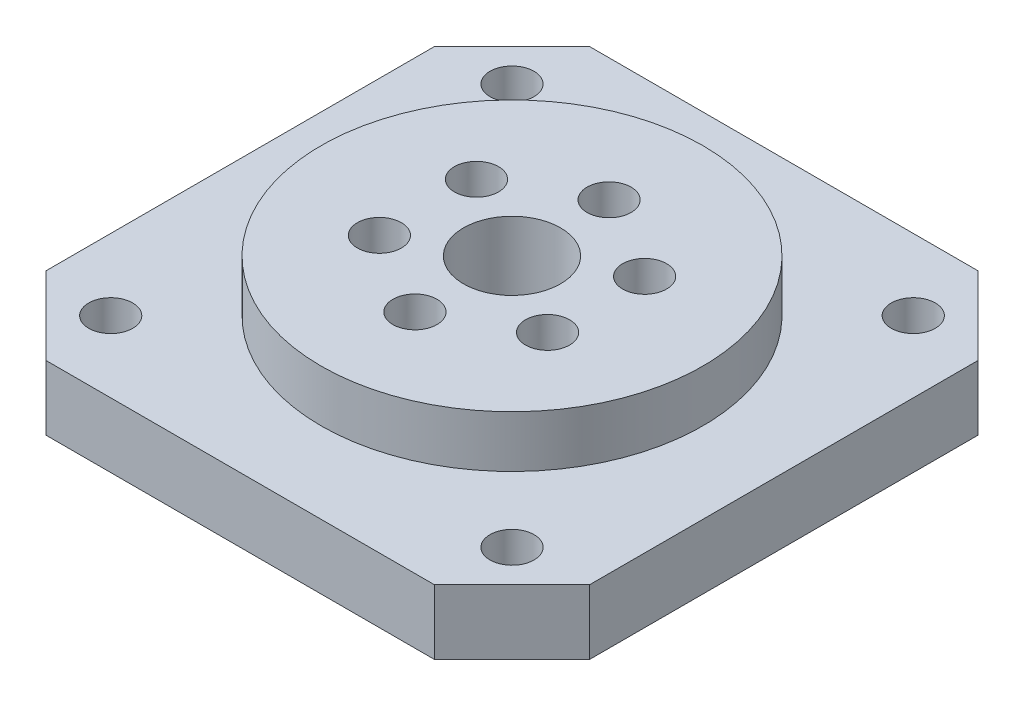
from build123d import *

# Parameters (mm, degrees)
BOSS_EXTRUDE1_DEPTH  = 5
M3_CLEARANCE_HOLE1_D = 3.4
SKETCH2_R            = 14.75
BOSS_EXTRUDE2_DEPTH  = 4
SKETCH4_R            = 12
CUT_EXTRUDE1_DEPTH   = 3.5
CUT_EXTRUDE2_DEPTH   = 2.5
SKETCH8_R            = 3.75
CUT_EXTRUDE3_DEPTH   = 31.203476621
SKETCH3_R            = 1.7
CUT_EXTRUDE4_DEPTH   = 32.032241298


with BuildPart() as part:
    # Sketch1 → Boss-Extrude1 (new body)
    with BuildSketch(Plane(origin=(0, 0, 0), x_dir=(1, 0, 0), z_dir=(0, 1, 0))):
        Polygon((-21, 15), (-21, -15), (-15, -21), (15, -21), (21, -15), (21, 15), (15, 21), (-15, 21), align=None)
    extrude(amount=BOSS_EXTRUDE1_DEPTH)

    # M3 Clearance Hole1 (through all)
    with Locations(Plane(origin=(0, 5, 0), x_dir=(1, 0, 0), z_dir=(0, 1, 0))):
        with Locations((15.5, 15.5), (-15.5, 15.5), (-15.5, -15.5), (15.5, -15.5)):
            Hole(M3_CLEARANCE_HOLE1_D / 2)

    # Sketch2 → Boss-Extrude2 (add)
    with BuildSketch(Plane(origin=(0, 5, 0), x_dir=(1, 0, 0), z_dir=(0, 1, 0))):
        with Locations(Location((0, 0, 0), (0, 0, 270))):
            Circle(SKETCH2_R)
    extrude(amount=BOSS_EXTRUDE2_DEPTH)

    # Sketch4 → Cut-Extrude1 (cut)
    with BuildSketch(Plane(origin=(0, 0, 0), x_dir=(-1, 0, 0), z_dir=(0, -1, 0))):
        with Locations(Location((0, 0, 0), (0, 0, 90))):
            Circle(SKETCH4_R)
    extrude(amount=-CUT_EXTRUDE1_DEPTH, mode=Mode.SUBTRACT)

    # Sketch7 → Cut-Extrude2 (cut)
    with BuildSketch(Plane.XZ.offset(-3.5)):
        Polygon((3.645190528, 2.104551733), (6.495190528, 0.459103466), (9.345190528, 2.104551733), (9.345190528, 5.395448267), (6.495190528, 7.040896534), (3.645190528, 5.395448267), align=None)
        Polygon((0, 4.209103466), (2.85, 5.854551733), (2.85, 9.145448267), (0, 10.790896534), (-2.85, 9.145448267), (-2.85, 5.854551733), align=None)
        Polygon((3.645190528, -2.104551733), (3.645190528, -5.395448267), (6.495190528, -7.040896534), (9.345190528, -5.395448267), (9.345190528, -2.104551733), (6.495190528, -0.459103466), align=None)
        Polygon((0, -4.209103466), (-2.85, -5.854551733), (-2.85, -9.145448267), (0, -10.790896534), (2.85, -9.145448267), (2.85, -5.854551733), align=None)
        Polygon((-3.645190528, -2.104551733), (-6.495190528, -0.459103466), (-9.345190528, -2.104551733), (-9.345190528, -5.395448267), (-6.495190528, -7.040896534), (-3.645190528, -5.395448267), align=None)
        Polygon((-3.645190528, 2.104551733), (-3.645190528, 5.395448267), (-6.495190528, 7.040896534), (-9.345190528, 5.395448267), (-9.345190528, 2.104551733), (-6.495190528, 0.459103466), align=None)
    extrude(amount=-CUT_EXTRUDE2_DEPTH, mode=Mode.SUBTRACT)

    # Sketch8 → Cut-Extrude3 (cut, through all)
    with BuildSketch(Plane.XZ.offset(-3.5)):
        with Locations(Location((0, 0, 0), (0, 0, 270))):
            Circle(SKETCH8_R)
    extrude(amount=-CUT_EXTRUDE3_DEPTH, mode=Mode.SUBTRACT)

    # Sketch3 → Cut-Extrude4 (cut, through all)
    with BuildSketch(Plane(origin=(0, 9, 0), x_dir=(1, 0, 0), z_dir=(0, 1, 0))):
        with Locations(Location((0, 7.5, 0), (0, 0, 270))):
            Circle(SKETCH3_R)
        with Locations(Location((6.495690528, 3.750866025, 0), (0, 0, 270))):
            Circle(SKETCH3_R)
        with Locations(Location((6.496690528, -3.749133975, 0), (0, 0, 270))):
            Circle(SKETCH3_R)
        with Locations(Location((0.002, -7.5, 0), (0, 0, 270))):
            Circle(SKETCH3_R)
        with Locations(Location((-6.493690528, -3.750866025, 0), (0, 0, 270))):
            Circle(SKETCH3_R)
        with Locations(Location((-6.494690528, 3.749133975, 0), (0, 0, 270))):
            Circle(SKETCH3_R)
    extrude(amount=-CUT_EXTRUDE4_DEPTH, mode=Mode.SUBTRACT)


solid = part.part
